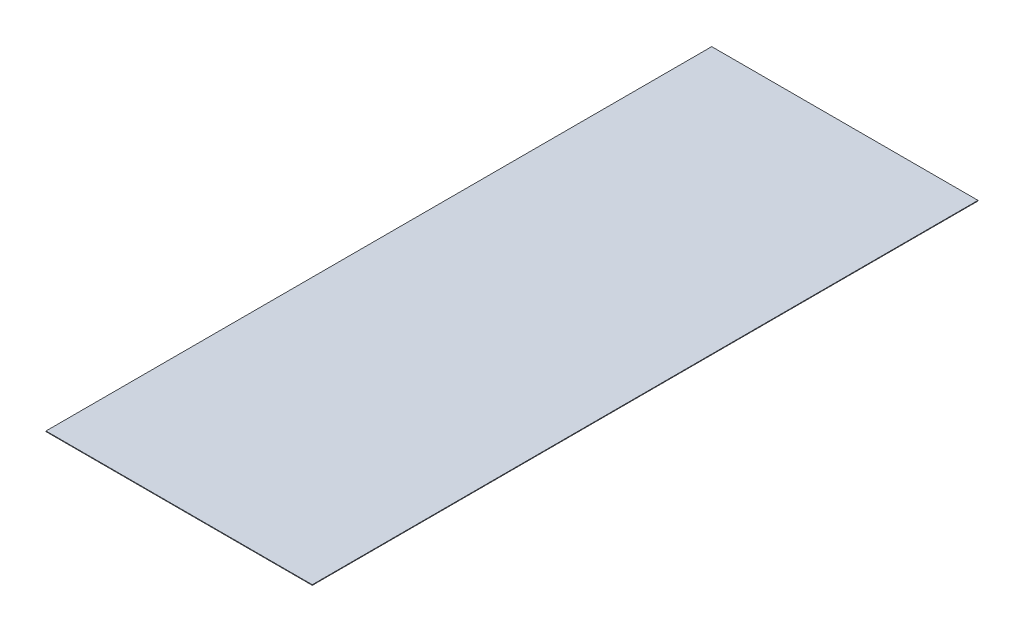
from build123d import *

# Parameters (mm, degrees)
CROQUIS1_W              = 1219.2
CROQUIS1_H              = 3048
SALIENTE_EXTRUIR1_DEPTH = 2.7


with BuildPart() as part:
    # Croquis1 → Saliente-Extruir1 (new body)
    with BuildSketch(Plane(origin=(0, 0, 0), x_dir=(1, 0, 0), z_dir=(0, 1, 0))):
        Rectangle(CROQUIS1_W, CROQUIS1_H)
    extrude(amount=SALIENTE_EXTRUIR1_DEPTH)


solid = part.part
